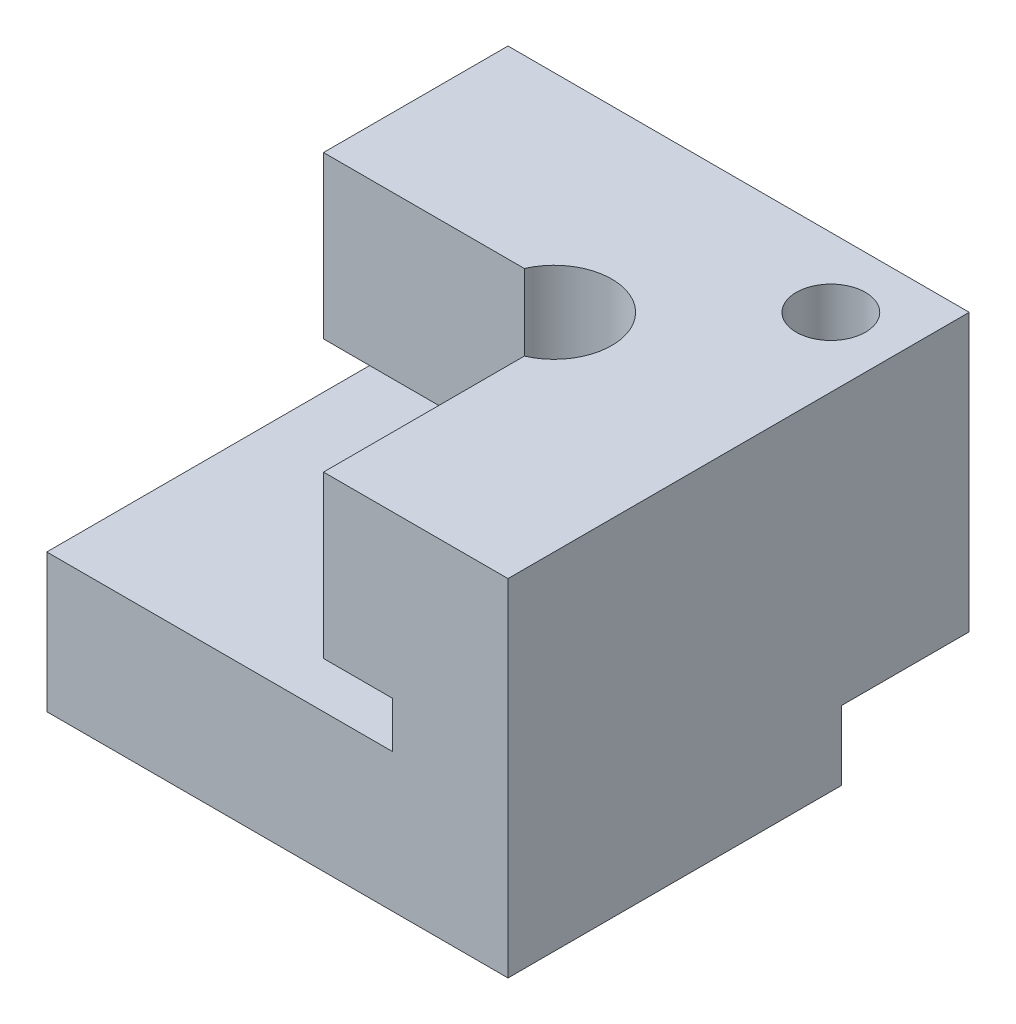
from build123d import *

# Parameters (mm, degrees)
SKETCH1_W           = 20
SKETCH1_H           = 20
BOSS_EXTRUDE1_DEPTH = 15
SKETCH2_W           = 12
SKETCH2_H           = 12
CUT_EXTRUDE1_DEPTH  = 9
SKETCH3_W           = 3
SKETCH3_H           = 2
CUT_EXTRUDE2_DEPTH  = 15
SKETCH4_W           = 3
SKETCH4_H           = 2
CUT_EXTRUDE3_DEPTH  = 15
SKETCH5_R           = 1.5
CUT_EXTRUDE4_DEPTH  = 15
SKETCH6_R           = 2.5
CUT_EXTRUDE5_DEPTH  = 12
CUT_EXTRUDE6_DEPTH  = 3
CUT_EXTRUDE7_DEPTH  = 3
CUT_EXTRUDE8_DEPTH  = 3


with BuildPart() as part:
    # Sketch1 → Boss-Extrude1 (new body)
    with BuildSketch(Plane(origin=(0, 0, 0), x_dir=(1, 0, 0), z_dir=(0, 1, 0))):
        with Locations((10, 10)):
            Rectangle(SKETCH1_W, SKETCH1_H)
    extrude(amount=BOSS_EXTRUDE1_DEPTH)

    # Sketch2 → Cut-Extrude1 (cut)
    with BuildSketch(Plane(origin=(0, 15, 0), x_dir=(1, 0, 0), z_dir=(0, 1, 0))):
        with Locations((6, 6)):
            Rectangle(SKETCH2_W, SKETCH2_H)
    extrude(amount=-CUT_EXTRUDE1_DEPTH, mode=Mode.SUBTRACT)

    # Sketch3 → Cut-Extrude2 (cut)
    with BuildSketch(Plane.XY):
        with Locations((13.5, 7)):
            Rectangle(SKETCH3_W, SKETCH3_H)
    extrude(amount=-CUT_EXTRUDE2_DEPTH, mode=Mode.SUBTRACT)

    # Sketch4 → Cut-Extrude3 (cut)
    with BuildSketch(Plane.ZY):
        with Locations((-13.5, 7)):
            Rectangle(SKETCH4_W, SKETCH4_H)
    extrude(amount=-CUT_EXTRUDE3_DEPTH, mode=Mode.SUBTRACT)

    # Sketch5 → Cut-Extrude4 (cut)
    with BuildSketch(Plane(origin=(0, 15, 0), x_dir=(1, 0, 0), z_dir=(0, 1, 0))):
        with Locations(Location((11, 11, 0), (0, 0, 270))):
            Circle(SKETCH5_R)
        with Locations(Location((17, 17, 0), (0, 0, 270))):
            Circle(SKETCH5_R)
    extrude(amount=-CUT_EXTRUDE4_DEPTH, mode=Mode.SUBTRACT)

    # Sketch6 → Cut-Extrude5 (cut)
    with BuildSketch(Plane(origin=(0, 15, 0), x_dir=(1, 0, 0), z_dir=(0, 1, 0))):
        with Locations(Location((11, 11, 0), (0, 0, 270))):
            Circle(SKETCH6_R)
    extrude(amount=-CUT_EXTRUDE5_DEPTH, mode=Mode.SUBTRACT)

    # Sketch7 → Cut-Extrude6 (cut)
    with BuildSketch(Plane(origin=(0, 0, 0), x_dir=(-1, 0, 0), z_dir=(0, -1, 0))):
        Polygon((-19.1, 14.71964915), (-16.075158234, 14.041171227), (-13.975158234, 16.321522077), (-14.9, 19.28035085), (-17.924841766, 19.958828773), (-20.024841766, 17.678477923), align=None)
    extrude(amount=-CUT_EXTRUDE6_DEPTH, mode=Mode.SUBTRACT)

    # Sketch8 → Cut-Extrude7 (cut)
    with BuildSketch(Plane(origin=(0, 0, 0), x_dir=(-1, 0, 0), z_dir=(0, -1, 0))):
        Polygon((-20, 14.71964915), (-19.1, 14.71964915), (-14.9, 19.28035085), (-14.9, 20), (-20, 20), align=None)
    extrude(amount=-CUT_EXTRUDE7_DEPTH, mode=Mode.SUBTRACT)

    # Sketch9 → Cut-Extrude8 (cut)
    with BuildSketch(Plane(origin=(0, 0, 0), x_dir=(-1, 0, 0), z_dir=(0, -1, 0))):
        Polygon((-13.673474415, 16.296986821), (-14.727909935, 19.529349074), (-14.727909935, 20), (-18.05443552, 20.232362253), (-20.326525585, 17.703013179), (-20.94475972, 14.470650926), (-19.272090065, 14.470650926), (-15.94556448, 13.767637747), align=None)
    extrude(amount=-CUT_EXTRUDE8_DEPTH, mode=Mode.SUBTRACT)


solid = part.part
